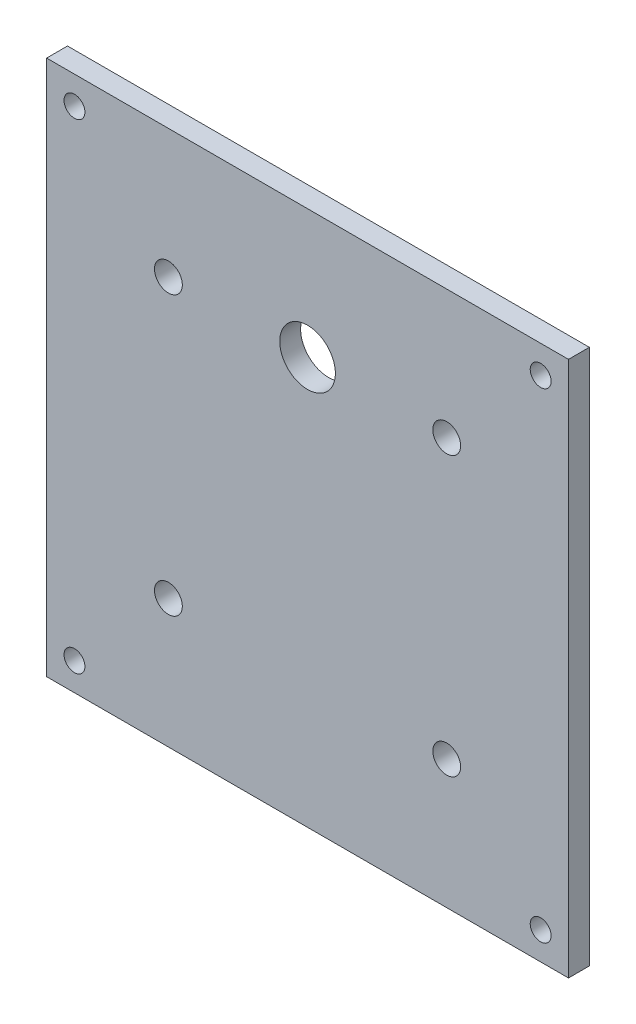
from build123d import *

# Parameters (mm, degrees)
SKETCH_1_W      = 75
SKETCH_1_H      = 77
SKETCH_1_R      = 1.5
SKETCH_1_R_2    = 2
SKETCH_1_R_3    = 4
EXTRUDE_1_DEPTH = 3


with BuildPart() as part:
    # 草图1 → 凸台-拉伸1 (new body)
    with BuildSketch(Plane.XY):
        with Locations((-25.653153153, -12.882882883)):
            Rectangle(SKETCH_1_W, SKETCH_1_H)
        with Locations((-59.153153153, 21.617117117)):
            Circle(SKETCH_1_R, mode=Mode.SUBTRACT)
        with Locations((7.846846847, 21.617117117)):
            Circle(SKETCH_1_R, mode=Mode.SUBTRACT)
        with Locations((-59.153153153, -47.382882883)):
            Circle(SKETCH_1_R, mode=Mode.SUBTRACT)
        with Locations((7.846846847, -47.382882883)):
            Circle(SKETCH_1_R, mode=Mode.SUBTRACT)
        with Locations((-5.653153153, -32.882882883)):
            Circle(SKETCH_1_R_2, mode=Mode.SUBTRACT)
        with Locations((-45.653153153, -32.882882883)):
            Circle(SKETCH_1_R_2, mode=Mode.SUBTRACT)
        with Locations((-45.653153153, 7.117117117)):
            Circle(SKETCH_1_R_2, mode=Mode.SUBTRACT)
        with Locations((-5.653153153, 7.117117117)):
            Circle(SKETCH_1_R_2, mode=Mode.SUBTRACT)
        with Locations((-25.653153153, 7.117117117)):
            Circle(SKETCH_1_R_3, mode=Mode.SUBTRACT)
    extrude(amount=EXTRUDE_1_DEPTH)


solid = part.part
